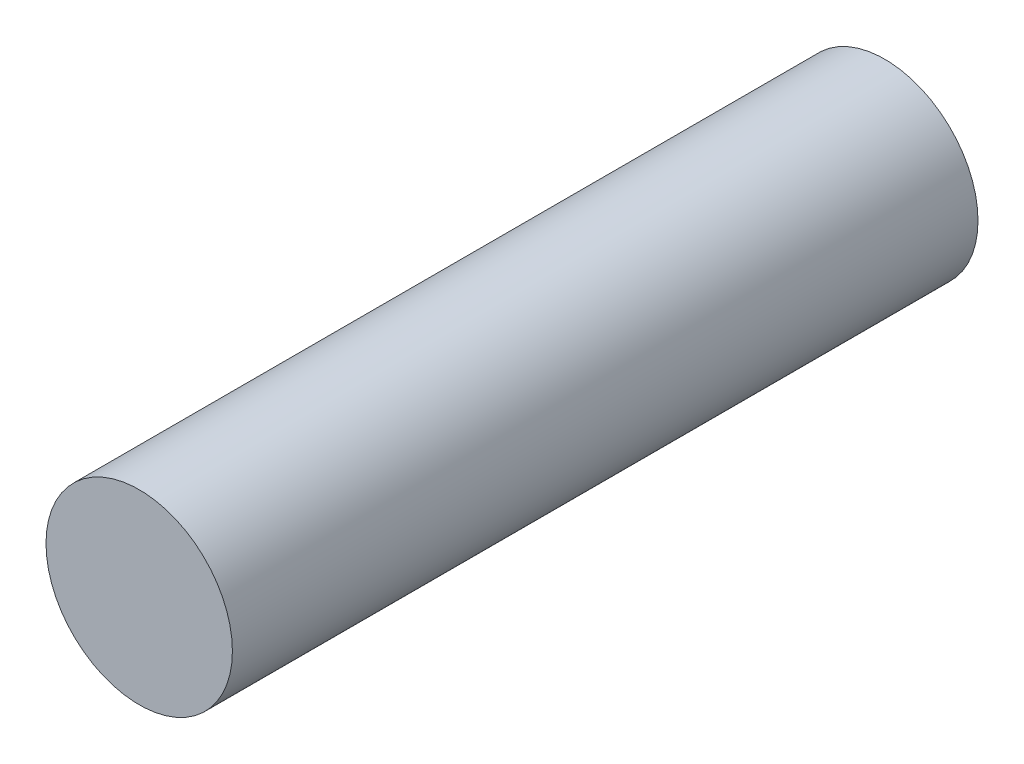
from build123d import *

# Parameters (mm, degrees)
DOWEL_DIAMETER_6P35MM_R   = 3.175
DOWEL_LENGTH_25P4MM_DEPTH = 25.4


with BuildPart() as part:
    # Dowel_diameter_6p35mm → Dowel_length_25p4mm (new body)
    with BuildSketch(Plane.XY):
        Circle(DOWEL_DIAMETER_6P35MM_R)
    extrude(amount=DOWEL_LENGTH_25P4MM_DEPTH)


solid = part.part
